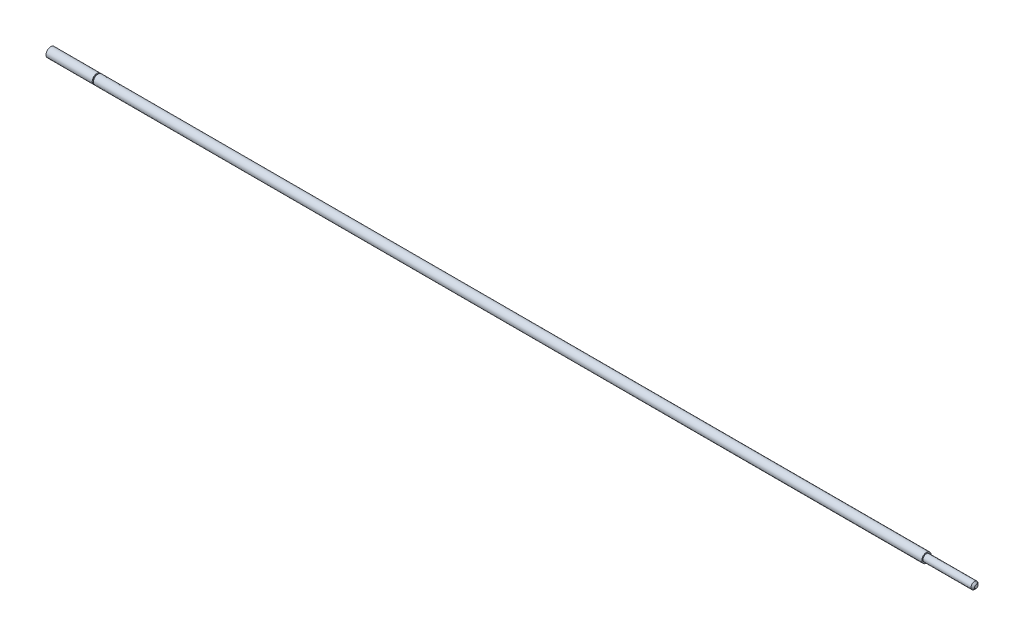
from build123d import *

# Parameters (mm, degrees)
SKETCH_1_R          = 4
EXTRUDE_1_DEPTH     = 39.5
SKETCH_2_R          = 3
EXTRUDE_2_DEPTH     = 1
SKETCH_3_R          = 4
EXTRUDE_3_DEPTH     = 707.5
SKETCH_4_R          = 3
EXTRUDE_4_DEPTH     = 42.5
CHAMFER_1_SIZE      = 1.5
CUT_EXTRUDE_1_DEPTH = 5


with BuildPart() as part:
    # 草图1 → 凸台-拉伸1 (new body)
    with BuildSketch(Plane(origin=(0, 0, 0), x_dir=(0, 0, -1), z_dir=(1, 0, 0))):
        Circle(SKETCH_1_R)
    extrude(amount=EXTRUDE_1_DEPTH)

    # 草图2 → 凸台-拉伸2 (add)
    with BuildSketch(Plane(origin=(39.5, 0, 0), x_dir=(0, 0, -1), z_dir=(1, 0, 0))):
        Circle(SKETCH_2_R)
    extrude(amount=EXTRUDE_2_DEPTH)

    # 草图3 → 凸台-拉伸3 (add)
    with BuildSketch(Plane(origin=(40.5, 0, 0), x_dir=(0, 0, -1), z_dir=(1, 0, 0))):
        Circle(SKETCH_3_R)
    extrude(amount=EXTRUDE_3_DEPTH)

    # 草图4 → 凸台-拉伸4 (add)
    with BuildSketch(Plane(origin=(748, 0, 0), x_dir=(0, 0, -1), z_dir=(1, 0, 0))):
        Circle(SKETCH_4_R)
    extrude(amount=EXTRUDE_4_DEPTH)

    # 倒角1
    chamfer_1_edges = [part.edges().sort_by_distance(p)[0] for p in [
        (790.5, 0, 3),
    ]]
    chamfer(chamfer_1_edges, length=CHAMFER_1_SIZE)

    # 草图7 → 切除-拉伸1 (cut)
    with BuildSketch(Plane.ZY):
        Polygon((-2.38156986, 1.375), (-2.38156986, -1.375), (0, -2.75), (2.38156986, -1.375), (2.38156986, 1.375), (0, 2.75), align=None)
    extrude(amount=-CUT_EXTRUDE_1_DEPTH, mode=Mode.SUBTRACT)


solid = part.part
